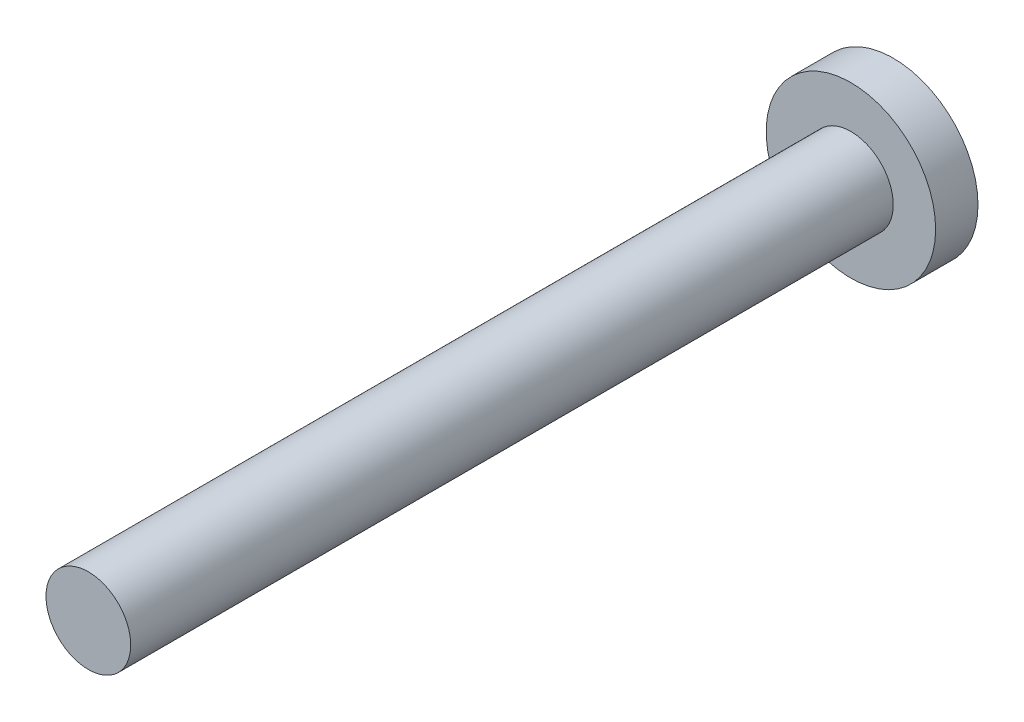
from build123d import *

# Parameters (mm, degrees)
SCHIZZO1_R                   = 10
ESTRUSIONE_ESTRUSIONE1_DEPTH = 5
SCHIZZO2_R                   = 5
ESTRUSIONE_ESTRUSIONE2_DEPTH = 90


with BuildPart() as part:
    # Schizzo1 → Estrusione-Estrusione1 (new body)
    with BuildSketch(Plane.XY):
        Circle(SCHIZZO1_R)
    extrude(amount=ESTRUSIONE_ESTRUSIONE1_DEPTH)

    # Schizzo2 → Estrusione-Estrusione2 (add)
    with BuildSketch(Plane.XY.offset(5)):
        with Locations(Location((0, 0, 0), (0, 0, 180))):
            Circle(SCHIZZO2_R)
    extrude(amount=ESTRUSIONE_ESTRUSIONE2_DEPTH)


solid = part.part
